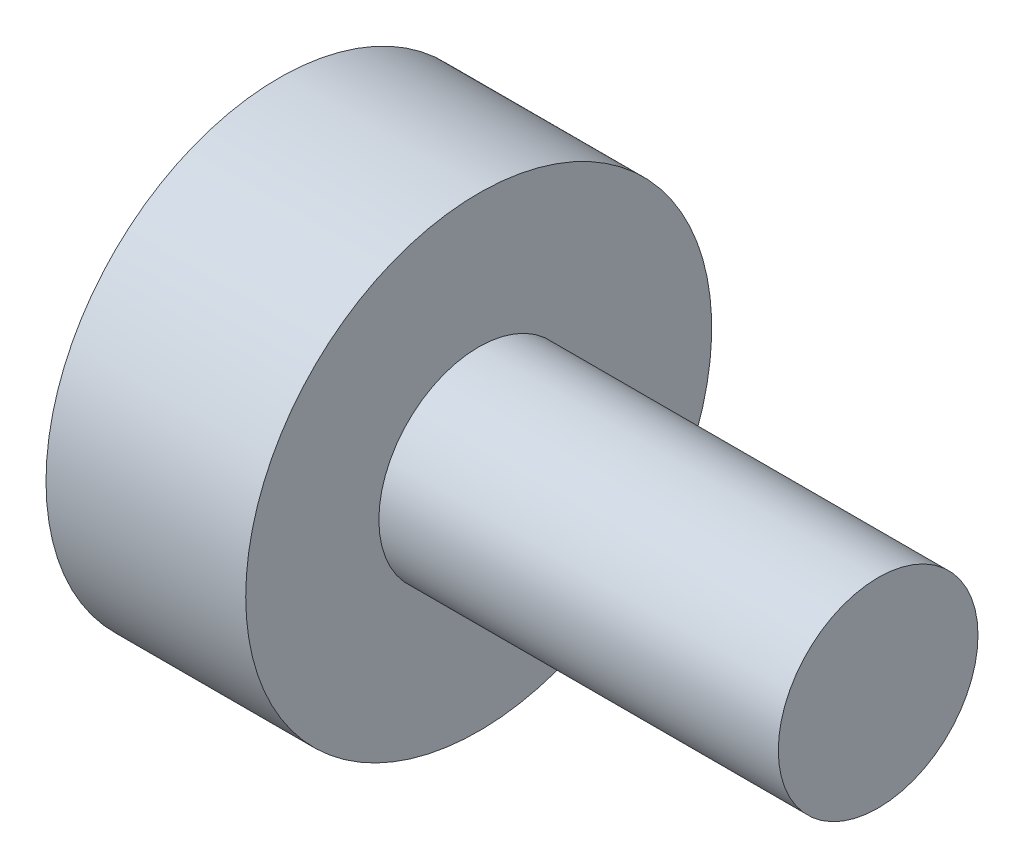
from build123d import *

# Parameters (mm, degrees)
SKETCH_2_R          = 5
CUT_EXTRUDE_1_DEPTH = 20


with BuildPart() as part:
    # Эскиз1 → Повернуть1 (revolve)
    with BuildSketch(Plane.XY, mode=Mode.PRIVATE) as revolve_1_sk:
        Polygon((0, 0), (100, 0), (100, 15), (40, 15), (40, 35), (10, 35), (10, 20), (0, 20), align=None)
    revolve(revolve_1_sk.sketch.rotate(Axis((0, 0, 0), (1, 0, 0)), 90), axis=Axis((0, 0, 0), (1, 0, 0)))

    # Эскиз2 → Вырез-Вытянуть1 (cut)
    with BuildSketch(Plane(origin=(0, 0, 0), x_dir=(0, 0, -1), z_dir=(1, 0, 0))):
        with Locations((10, 0)):
            Circle(SKETCH_2_R)
    extrude(amount=CUT_EXTRUDE_1_DEPTH, mode=Mode.SUBTRACT)


solid = part.part
